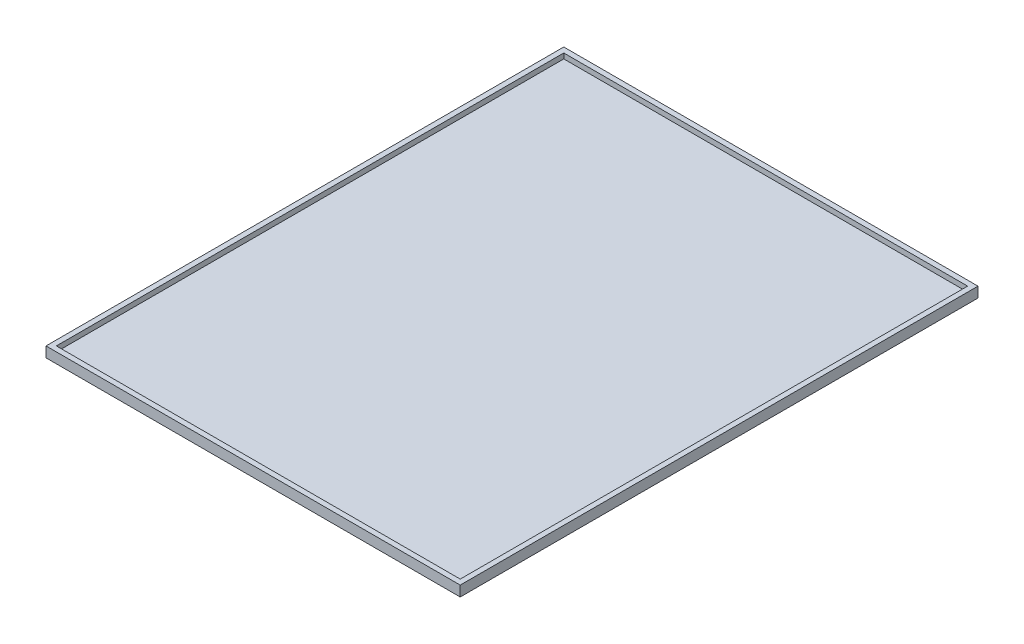
from build123d import *

# Parameters (mm, degrees)
SKETCH1_W      = 400
SKETCH1_H      = 500
EXTRUDE1_DEPTH = 10
SHELL1_T       = -5


with BuildPart() as part:
    # Sketch1 → Extrude1 (new body)
    with BuildSketch(Plane(origin=(0, 0, 0), x_dir=(1, 0, 0), z_dir=(0, 1, 0))):
        with Locations((200, 250)):
            Rectangle(SKETCH1_W, SKETCH1_H)
    extrude(amount=-EXTRUDE1_DEPTH)

    # Shell1
    shell1_openings = [part.faces().sort_by_distance(p)[0] for p in [
        (200, 0, -250),
    ]]
    offset(amount=SHELL1_T, openings=shell1_openings, kind=Kind.INTERSECTION)


solid = part.part
